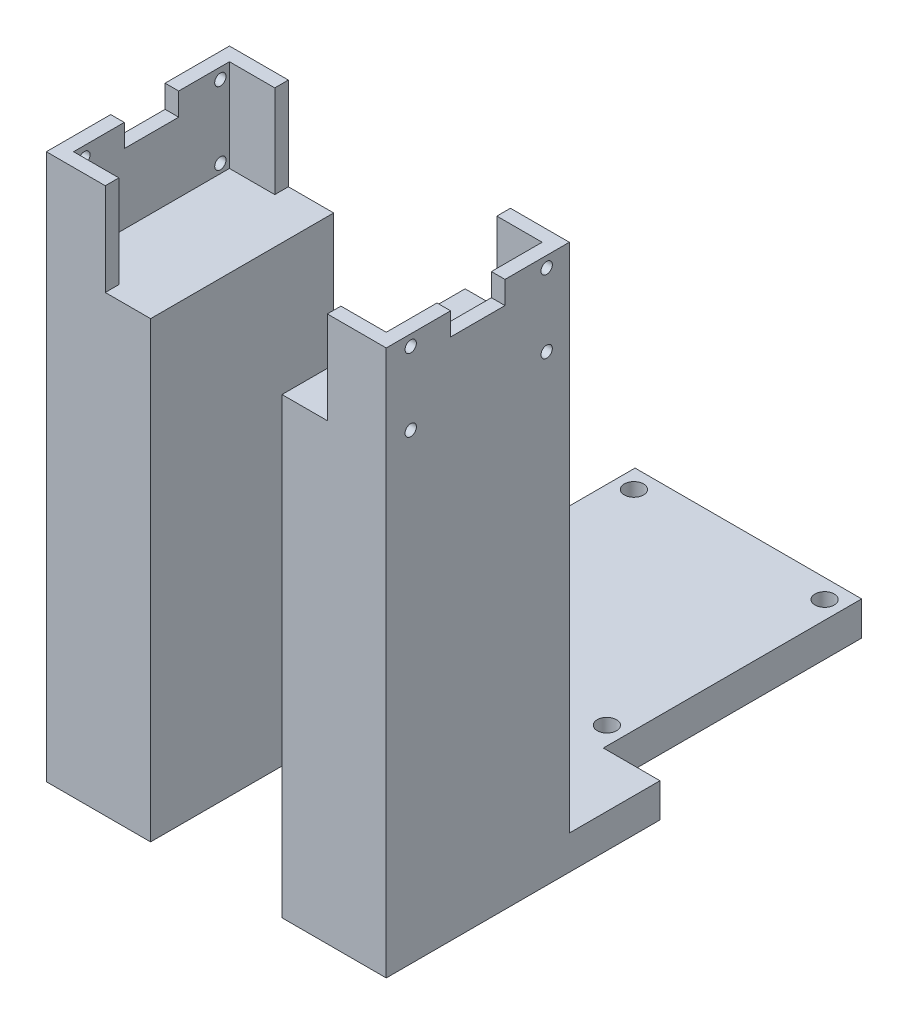
from build123d import *

# Parameters (mm, degrees)
BOSS_EXTRUDE1_START = -34.5
SKETCH2_W           = 34.4
SKETCH2_H           = 20.4
SKETCH2_R           = 1.25
BOSS_EXTRUDE1_DEPTH = 3
SKETCH1_W           = 13
SKETCH1_H           = 3
BOSS_EXTRUDE2_DEPTH = 20.4
SKETCH1_3_W         = 20
SKETCH1_3_H         = 34.4
SKETCH1_3_W_2       = 10
SKETCH1_3_H_2       = 3
SKETCH1_3_W_3       = 3
BOSS_EXTRUDE3_DEPTH = 3
SKETCH1_4_W         = 3
SKETCH1_4_H         = 34.4
SKETCH1_4_W_2       = 10
SKETCH1_4_H_2       = 3
SKETCH1_4_W_3       = 20
BOSS_EXTRUDE4_DEPTH = 100
SKETCH4_W           = 12
SKETCH4_H           = 10
CUT_EXTRUDE1_DEPTH  = 132
SKETCH7_W           = 50
SKETCH7_H           = 57
SKETCH7_R           = 2.125
BOSS_EXTRUDE5_DEPTH = 7.5


with BuildPart() as part:
    # Sketch2 → Boss-Extrude1 (new body)
    with BuildSketch(Plane(origin=(0, 0, 0), x_dir=(0, 0, -1), z_dir=(1, 0, 0)).offset(BOSS_EXTRUDE1_START)):
        with Locations((0, 10.2)):
            Rectangle(SKETCH2_W, SKETCH2_H)
        with Locations((-14.8, 18)):
            Circle(SKETCH2_R, mode=Mode.SUBTRACT)
        with Locations(Location((-14.8, 2, 0), (0, 0, 180))):
            Circle(SKETCH2_R, mode=Mode.SUBTRACT)
        with Locations((15.2, 2)):
            Circle(SKETCH2_R, mode=Mode.SUBTRACT)
        with Locations(Location((15.2, 18, 0), (0, 0, 180))):
            Circle(SKETCH2_R, mode=Mode.SUBTRACT)
    extrude(amount=-BOSS_EXTRUDE1_DEPTH)

    # Sketch1 → Boss-Extrude2 (add)
    with BuildSketch(Plane(origin=(0, 0, 0), x_dir=(1, 0, 0), z_dir=(0, 1, 0))):
        with Locations((-31, -18.7)):
            Rectangle(SKETCH1_W, SKETCH1_H)
        with Locations((-31, 18.7)):
            Rectangle(SKETCH1_W, SKETCH1_H)
    extrude(amount=BOSS_EXTRUDE2_DEPTH)

    # Sketch1<3> → Boss-Extrude3 (add)
    with BuildSketch(Plane(origin=(0, 0, 0), x_dir=(1, 0, 0), z_dir=(0, 1, 0))):
        with Locations((-24.5, 0)):
            Rectangle(SKETCH1_3_W, SKETCH1_3_H)
        with Locations((-19.5, -18.7)):
            Rectangle(SKETCH1_3_W_2, SKETCH1_3_H_2)
        Polygon((-24.5, -20.2), (-24.5, -17.2), (-34.5, -17.2), (-37.5, -17.2), (-37.5, -20.2), align=None)
        with Locations((-36, 0)):
            Rectangle(SKETCH1_3_W_3, SKETCH1_3_H)
        Polygon((-34.5, 17.2), (-24.5, 17.2), (-24.5, 20.2), (-37.5, 20.2), (-37.5, 17.2), align=None)
        with Locations((-19.5, 18.7)):
            Rectangle(SKETCH1_3_W_2, SKETCH1_3_H_2)
    extrude(amount=-BOSS_EXTRUDE3_DEPTH)

    # Sketch1<4> → Boss-Extrude4 (add)
    with BuildSketch(Plane(origin=(0, 0, 0), x_dir=(1, 0, 0), z_dir=(0, 1, 0))):
        with Locations((-36, 0)):
            Rectangle(SKETCH1_4_W, SKETCH1_4_H)
        Polygon((-24.5, -20.2), (-24.5, -17.2), (-34.5, -17.2), (-37.5, -17.2), (-37.5, -20.2), align=None)
        with Locations((-19.5, -18.7)):
            Rectangle(SKETCH1_4_W_2, SKETCH1_4_H_2)
        with Locations((-24.5, 0)):
            Rectangle(SKETCH1_4_W_3, SKETCH1_4_H)
        Polygon((-34.5, 17.2), (-24.5, 17.2), (-24.5, 20.2), (-37.5, 20.2), (-37.5, 17.2), align=None)
        with Locations((-19.5, 18.7)):
            Rectangle(SKETCH1_4_W_2, SKETCH1_4_H_2)
    extrude(amount=-BOSS_EXTRUDE4_DEPTH)

    # Sketch4 → Cut-Extrude1 (cut)
    with BuildSketch(Plane(origin=(-34.5, 0, 0), x_dir=(0, 0, -1), z_dir=(1, 0, 0))):
        with Locations((0, 20.4)):
            Rectangle(SKETCH4_W, SKETCH4_H)
    extrude(amount=-CUT_EXTRUDE1_DEPTH, mode=Mode.SUBTRACT)


with BuildPart() as body_2:
    # Mirror6: mirrored copy
    add(part.part.mirror(Plane(origin=(0, 0, 0), x_dir=(0, 0, 1), z_dir=(1, 0, 0))))


with BuildPart() as part_1:
    add(part.part)

    add(body_2.part)  # Boss-Extrude5 merges body 2
    # Sketch7 → Boss-Extrude5 (add)
    # profile 1 of 2: a face of its own
    with BuildSketch(Plane.XZ.offset(100)):
        Polygon((-14.5, -20.2), (14.5, -20.2), (37.5, -20.2), (37.5, -40.2), (-37.5, -40.2), (-37.5, -20.2), align=None)
        with BuildLine():
            ThreePointArc((-15, -28.5), (-18, -25.5), (-21, -28.5))
            Line((-21, -28.5), (-21, -32.5))
            ThreePointArc((-21, -32.5), (-18, -35.5), (-15, -32.5))
            Line((-15, -32.5), (-15, -28.5))
        make_face(mode=Mode.SUBTRACT)
        with BuildLine():
            ThreePointArc((21, -28.5), (18, -25.5), (15, -28.5))
            Line((15, -28.5), (15, -32.5))
            ThreePointArc((15, -32.5), (18, -35.5), (21, -32.5))
            Line((21, -32.5), (21, -28.5))
        make_face(mode=Mode.SUBTRACT)
    # profile 2 of 2: a face of its own
    with BuildSketch(Plane.XZ.offset(100)):
        with Locations((0, -68.7)):
            Rectangle(SKETCH7_W, SKETCH7_H)
        with Locations(Location((-21.035, -92.99, 0), (0, 0, 270))):
            Circle(SKETCH7_R, mode=Mode.SUBTRACT)
        with Locations(Location((21.035, -92.99, 0), (0, 0, 270))):
            Circle(SKETCH7_R, mode=Mode.SUBTRACT)
        with Locations(Location((-21.035, -44.95, 0), (0, 0, 270))):
            Circle(SKETCH7_R, mode=Mode.SUBTRACT)
        with Locations(Location((21.035, -44.95, 0), (0, 0, 270))):
            Circle(SKETCH7_R, mode=Mode.SUBTRACT)
    extrude(amount=-BOSS_EXTRUDE5_DEPTH)


solid = part_1.part
